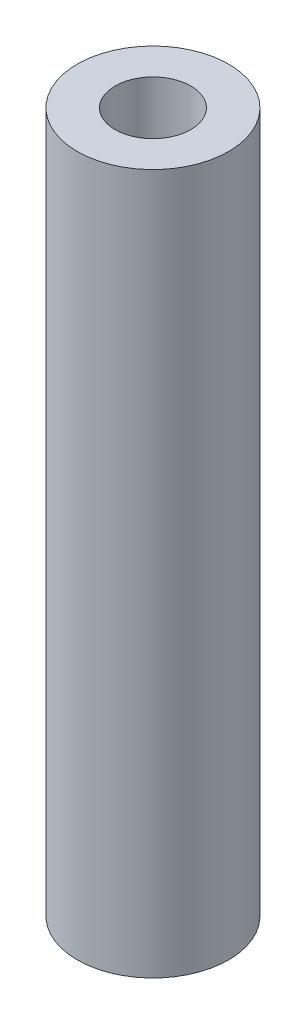
from build123d import *

# Parameters (mm, degrees)
SKETCH1_R           = 4
SKETCH1_R_2         = 2
BOSS_EXTRUDE1_DEPTH = 37


with BuildPart() as part:
    # Sketch1 → Boss-Extrude1 (new body)
    with BuildSketch(Plane(origin=(0, 0, 0), x_dir=(1, 0, 0), z_dir=(0, 1, 0))):
        with Locations(Location((0, 0, 0), (0, 0, 270))):
            Circle(SKETCH1_R)
        with Locations(Location((0, 0, 0), (0, 0, 270))):
            Circle(SKETCH1_R_2, mode=Mode.SUBTRACT)
    extrude(amount=BOSS_EXTRUDE1_DEPTH)


solid = part.part
